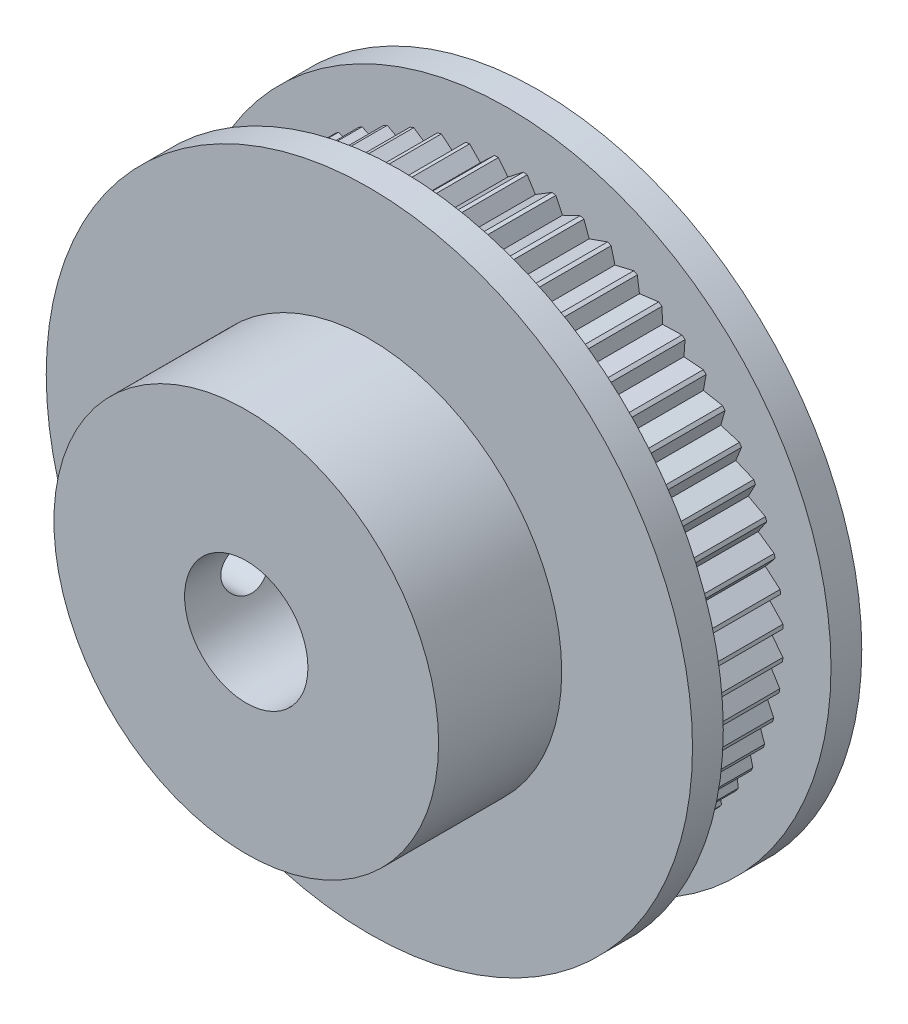
from build123d import *

# Parameters (mm, degrees)
SKETCH1_R                 = 21
BOSS_EXTRUDE1_DEPTH       = 11
SKETCH2_R                 = 12.5
BOSS_EXTRUDE2_DEPTH       = 8
SKETCH3_R                 = 4.0075
CUT_EXTRUDE1_DEPTH        = 20
CUT_EXTRUDE5_START        = -2
CUT_EXTRUDE5_DEPTH        = 7
CUT_EXTRUDE6_START        = -2
SKETCH5_R                 = 21.042635215
SKETCH5_R_2               = 17.9
CUT_EXTRUDE6_DEPTH        = 7
M4X0_7_TAPPED_HOLE1_D     = 3.3
M4X0_7_TAPPED_HOLE1_DEPTH = 11.5
M4X0_7_TAPPED_HOLE1_TIP   = 0.991420021


with BuildPart() as part:
    # Sketch1 → Boss-Extrude1 (new body)
    with BuildSketch(Plane.XY):
        Circle(SKETCH1_R)
    extrude(amount=BOSS_EXTRUDE1_DEPTH)

    # Sketch2 → Boss-Extrude2 (add)
    with BuildSketch(Plane.XY.offset(11)):
        Circle(SKETCH2_R)
    extrude(amount=BOSS_EXTRUDE2_DEPTH)

    # Sketch3 → Cut-Extrude1 (cut)
    with BuildSketch(Plane.XY.offset(19)):
        Circle(SKETCH3_R)
    extrude(amount=-CUT_EXTRUDE1_DEPTH, mode=Mode.SUBTRACT)

    # Sketch4 → Cut-Extrude5 (cut)
    with BuildSketch(Plane.XY.offset(11).offset(CUT_EXTRUDE5_START)):
        Polygon((0, 17.103839282), (1.167293613, 18), (-0.703728041, 18), align=None)
        Polygon((1.787838036, 17.010142661), (3.042411396, 17.779378709), (1.181639394, 17.974953727), align=None)
        Polygon((3.556088145, 16.730079357), (4.884195882, 17.363962824), (3.05406054, 17.7529701), align=None)
        Polygon((5.285377007, 16.266717803), (6.672468096, 16.758303729), (4.89302076, 17.336481217), align=None)
        Polygon((6.956758173, 15.625134685), (8.387635354, 15.969037152), (6.67837202, 16.730050218), align=None)
        Polygon((8.551919641, 14.812359321), (10.010905923, 15.004810461), (8.390553639, 15.940321288), align=None)
        Polygon((10.053384488, 13.837296649), (11.524494912, 13.876187928), (10.010806597, 14.975946863), align=None)
        Polygon((11.44470235, 12.710629659), (12.911819123, 12.595534975), (11.521379062, 13.847492829), align=None)
        Polygon((12.710629659, 11.44470235), (14.157678742, 11.176882706), (12.905720888, 12.567322766), align=None)
        Polygon((13.837296649, 10.053384488), (15.24842387, 9.635774171), (14.148664935, 11.149462486), align=None)
        Polygon((14.812359321, 8.551919641), (16.172104075, 7.989094077), (15.236593248, 9.609446361), align=None)
        Polygon((15.625134685, 6.956758173), (16.918599323, 6.254883797), (16.157586257, 7.96414713), align=None)
        Polygon((16.266717803, 5.285377007), (17.479730857, 4.452143701), (16.901553369, 6.231591038), align=None)
        Polygon((16.730079357, 3.556088145), (17.849350802, 2.600624987), (17.460343526, 4.430760329), align=None)
        Polygon((17.010142661, 1.787838036), (18.023409524, 0.720613282), (17.827834506, 2.581385284), align=None)
        Polygon((17.103839282, 0), (18, -1.167293613), (18, 0.703728041), align=None)
        Polygon((17.010142661, -1.787838036), (17.779378709, -3.042411396), (17.974953727, -1.181639394), align=None)
        Polygon((16.730079357, -3.556088145), (17.363962824, -4.884195882), (17.7529701, -3.05406054), align=None)
        Polygon((16.266717803, -5.285377007), (16.758303729, -6.672468096), (17.336481217, -4.89302076), align=None)
        Polygon((15.625134685, -6.956758173), (15.969037152, -8.387635354), (16.730050218, -6.67837202), align=None)
        Polygon((14.812359321, -8.551919641), (15.004810461, -10.010905923), (15.940321288, -8.390553639), align=None)
        Polygon((13.837296649, -10.053384488), (13.876187928, -11.524494912), (14.975946863, -10.010806597), align=None)
        Polygon((12.710629659, -11.44470235), (12.595534975, -12.911819123), (13.847492829, -11.521379062), align=None)
        Polygon((11.44470235, -12.710629659), (11.176882706, -14.157678742), (12.567322766, -12.905720888), align=None)
        Polygon((10.053384488, -13.837296649), (9.635774171, -15.24842387), (11.149462486, -14.148664935), align=None)
        Polygon((8.551919641, -14.812359321), (7.989094077, -16.172104075), (9.609446361, -15.236593248), align=None)
        Polygon((6.956758173, -15.625134685), (6.254883797, -16.918599323), (7.96414713, -16.157586257), align=None)
        Polygon((5.285377007, -16.266717803), (4.452143701, -17.479730857), (6.231591038, -16.901553369), align=None)
        Polygon((3.556088145, -16.730079357), (2.600624987, -17.849350802), (4.430760329, -17.460343526), align=None)
        Polygon((1.787838036, -17.010142661), (0.720613282, -18.023409524), (2.581385284, -17.827834506), align=None)
        Polygon((0, -17.103839282), (-1.167293613, -18), (0.703728041, -18), align=None)
        Polygon((-1.787838036, -17.010142661), (-3.042411396, -17.779378709), (-1.181639394, -17.974953727), align=None)
        Polygon((-3.556088145, -16.730079357), (-4.884195882, -17.363962824), (-3.05406054, -17.7529701), align=None)
        Polygon((-5.285377007, -16.266717803), (-6.672468096, -16.758303729), (-4.89302076, -17.336481217), align=None)
        Polygon((-6.956758173, -15.625134685), (-8.387635354, -15.969037152), (-6.67837202, -16.730050218), align=None)
        Polygon((-8.551919641, -14.812359321), (-10.010905923, -15.004810461), (-8.390553639, -15.940321288), align=None)
        Polygon((-10.053384488, -13.837296649), (-11.524494912, -13.876187928), (-10.010806597, -14.975946863), align=None)
        Polygon((-11.44470235, -12.710629659), (-12.911819123, -12.595534975), (-11.521379062, -13.847492829), align=None)
        Polygon((-12.710629659, -11.44470235), (-14.157678742, -11.176882706), (-12.905720888, -12.567322766), align=None)
        Polygon((-13.837296649, -10.053384488), (-15.24842387, -9.635774171), (-14.148664935, -11.149462486), align=None)
        Polygon((-14.812359321, -8.551919641), (-16.172104075, -7.989094077), (-15.236593248, -9.609446361), align=None)
        Polygon((-15.625134685, -6.956758173), (-16.918599323, -6.254883797), (-16.157586257, -7.96414713), align=None)
        Polygon((-16.266717803, -5.285377007), (-17.479730857, -4.452143701), (-16.901553369, -6.231591038), align=None)
        Polygon((-16.730079357, -3.556088145), (-17.849350802, -2.600624987), (-17.460343526, -4.430760329), align=None)
        Polygon((-17.010142661, -1.787838036), (-18.023409524, -0.720613282), (-17.827834506, -2.581385284), align=None)
        Polygon((-17.103839282, 0), (-18, 1.167293613), (-18, -0.703728041), align=None)
        Polygon((-17.010142661, 1.787838036), (-17.779378709, 3.042411396), (-17.974953727, 1.181639394), align=None)
        Polygon((-16.730079357, 3.556088145), (-17.363962824, 4.884195882), (-17.7529701, 3.05406054), align=None)
        Polygon((-16.266717803, 5.285377007), (-16.758303729, 6.672468096), (-17.336481217, 4.89302076), align=None)
        Polygon((-15.625134685, 6.956758173), (-15.969037152, 8.387635354), (-16.730050218, 6.67837202), align=None)
        Polygon((-14.812359321, 8.551919641), (-15.004810461, 10.010905923), (-15.940321288, 8.390553639), align=None)
        Polygon((-13.837296649, 10.053384488), (-13.876187928, 11.524494912), (-14.975946863, 10.010806597), align=None)
        Polygon((-12.710629659, 11.44470235), (-12.595534975, 12.911819123), (-13.847492829, 11.521379062), align=None)
        Polygon((-11.44470235, 12.710629659), (-11.176882706, 14.157678742), (-12.567322766, 12.905720888), align=None)
        Polygon((-10.053384488, 13.837296649), (-9.635774171, 15.24842387), (-11.149462486, 14.148664935), align=None)
        Polygon((-8.551919641, 14.812359321), (-7.989094077, 16.172104075), (-9.609446361, 15.236593248), align=None)
        Polygon((-6.956758173, 15.625134685), (-6.254883797, 16.918599323), (-7.96414713, 16.157586257), align=None)
        Polygon((-5.285377007, 16.266717803), (-4.452143701, 17.479730857), (-6.231591038, 16.901553369), align=None)
        Polygon((-3.556088145, 16.730079357), (-2.600624987, 17.849350802), (-4.430760329, 17.460343526), align=None)
        Polygon((-1.787838036, 17.010142661), (-0.720613282, 18.023409524), (-2.581385284, 17.827834506), align=None)
    extrude(amount=-CUT_EXTRUDE5_DEPTH, mode=Mode.SUBTRACT)

    # Sketch5 → Cut-Extrude6 (cut)
    with BuildSketch(Plane.XY.offset(11).offset(CUT_EXTRUDE6_START)):
        Circle(SKETCH5_R)
        Circle(SKETCH5_R_2, mode=Mode.SUBTRACT)
    extrude(amount=-CUT_EXTRUDE6_DEPTH, mode=Mode.SUBTRACT)

    # M4x0.7 Tapped Hole1
    with Locations(Plane.ZY.offset(12.5)):
        with Locations((15, 0)):
            Hole(M4X0_7_TAPPED_HOLE1_D / 2, depth=M4X0_7_TAPPED_HOLE1_DEPTH)
            with Locations((0, 0, -(M4X0_7_TAPPED_HOLE1_DEPTH + M4X0_7_TAPPED_HOLE1_TIP / 2))):  # 118° drill point
                Cone(0, M4X0_7_TAPPED_HOLE1_D / 2, M4X0_7_TAPPED_HOLE1_TIP, mode=Mode.SUBTRACT)


solid = part.part
